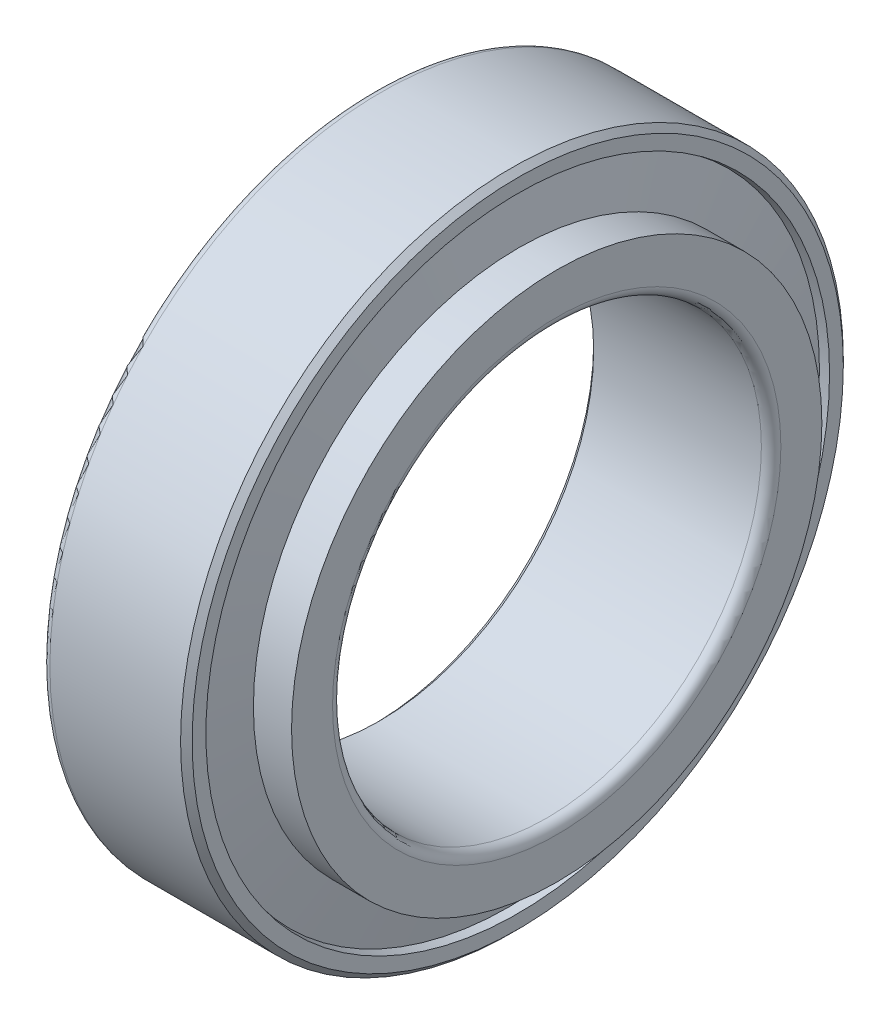
from build123d import *


with BuildPart() as part:
    # OutRacSke → OuterRace (revolve)
    with BuildSketch(Plane.XY):
        with BuildLine():
            Line((-10, 79.990044662), (-47, 73.1325))
            Line((-47, 73.1325), (-47, 83))
            ThreePointArc((-47, 83), (-46.414213562, 84.414213562), (-45, 85))
            Line((-45, 85), (-11.48, 85))
            Line((-11.48, 85), (-10, 83.52))
            Line((-10, 83.52), (-10, 79.990044662))
        make_face()
    revolve(axis=Axis((-42.5, 0, 0), (1, 0, 0)))

    # RolSimSke → RollersSimplified (revolve)
    with BuildSketch(Plane.XY):
        Polygon((-45, 73.87069398), (-12.257611578, 79.939136979), (-9.797431984, 66.665195727), (-42.539820406, 60.596752728), align=None)
    revolve(axis=Axis((0, 0, 0), (-1, 0, 0)))

    # InsRacSke → InnerRace (revolve)
    with BuildSketch(Plane.XY):
        with BuildLine():
            Line((-42.652623366, 61.271752727), (-47, 61.271752727))
            Line((-47, 61.271752727), (-47, 56.48))
            Line((-47, 56.48), (-45.52, 55))
            Line((-45.52, 55), (-2.5, 55))
            ThreePointArc((-2.5, 55), (-0.732233047, 55.732233047), (0, 57.5))
            Line((0, 57.5), (0, 68.015195726))
            Line((0, 68.015195726), (-9.785131089, 68.015195726))
            Line((-9.785131089, 68.015195726), (-9.785131089, 66.665195726))
            Line((-9.785131089, 66.665195726), (-42.527519511, 60.596752727))
            Line((-42.527519511, 60.596752727), (-42.652623366, 61.271752727))
        make_face()
    revolve(axis=Axis((-42.5, 0, 0), (1, 0, 0)))


solid = part.part
